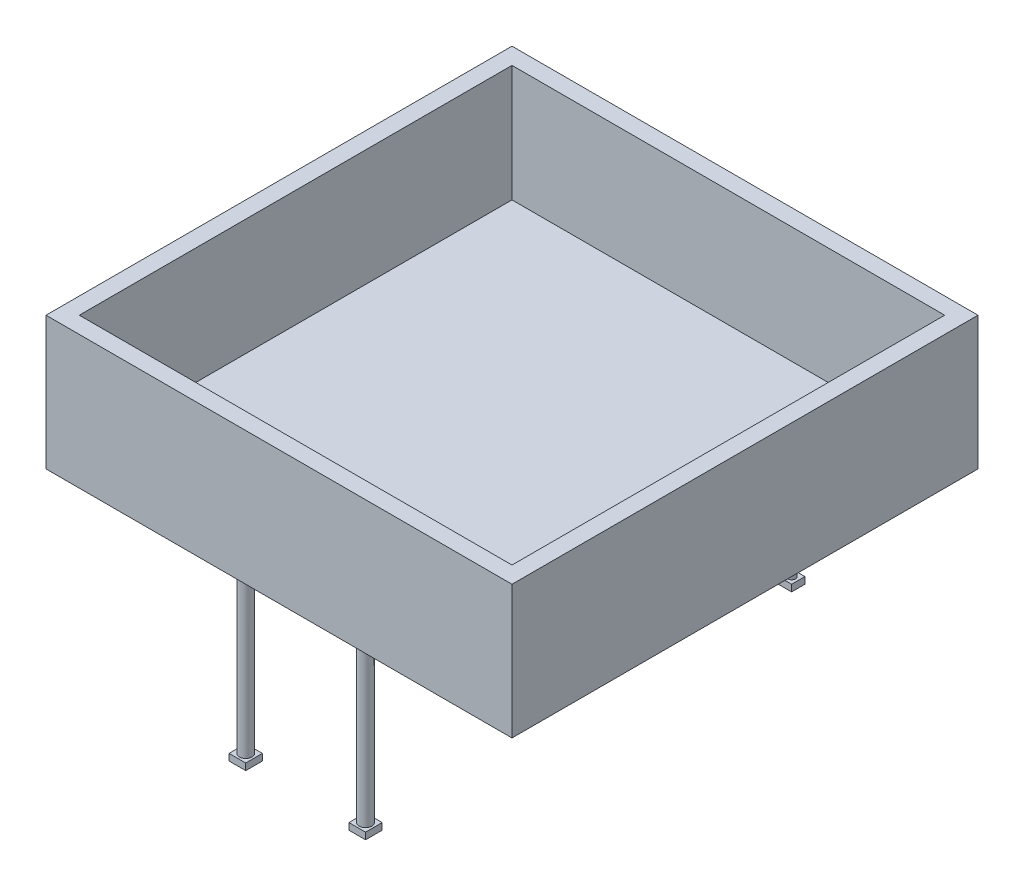
from build123d import *

# Parameters (mm, degrees)
CROQUIS1_W              = 140
CROQUIS1_H              = 140
SALIENTE_EXTRUIR1_DEPTH = 40
CROQUIS3_W              = 130
CROQUIS3_H              = 130
CORTAR_EXTRUIR1_DEPTH   = 35
CROQUIS5_R              = 1.2
CROQUIS5_R_2            = 1.9
SALIENTE_EXTRUIR4_DEPTH = 50
CROQUIS6_W              = 5
CROQUIS6_H              = 5
CROQUIS6_W_2            = 4
CROQUIS6_H_2            = 4
SALIENTE_EXTRUIR5_DEPTH = 2


with BuildPart() as part:
    # Croquis1 → Saliente-Extruir1 (new body)
    with BuildSketch(Plane(origin=(0, 0, 0), x_dir=(1, 0, 0), z_dir=(0, 1, 0))):
        Rectangle(CROQUIS1_W, CROQUIS1_H)
    extrude(amount=SALIENTE_EXTRUIR1_DEPTH)

    # Croquis3 → Cortar-Extruir1 (cut)
    with BuildSketch(Plane(origin=(0, 40, 0), x_dir=(1, 0, 0), z_dir=(0, 1, 0))):
        Rectangle(CROQUIS3_W, CROQUIS3_H)
    extrude(amount=-CORTAR_EXTRUIR1_DEPTH, mode=Mode.SUBTRACT)

    # Croquis5 → Saliente-Extruir4 (add)
    with BuildSketch(Plane.XZ):
        with Locations(Location((-16, -64, 0), (0, 0, 90))):
            Circle(CROQUIS5_R)
        with Locations(Location((-16, 64, 0), (0, 0, 90))):
            Circle(CROQUIS5_R_2)
        with Locations(Location((20, 64, 0), (0, 0, 90))):
            Circle(CROQUIS5_R_2)
        with Locations(Location((20, -64, 0), (0, 0, 90))):
            Circle(CROQUIS5_R)
    extrude(amount=SALIENTE_EXTRUIR4_DEPTH)

    # Croquis6 → Saliente-Extruir5 (add)
    with BuildSketch(Plane.XZ.offset(50)):
        with Locations((-16, 64)):
            Rectangle(CROQUIS6_W, CROQUIS6_H)
        with Locations((20, 64)):
            Rectangle(CROQUIS6_W, CROQUIS6_H)
        with Locations((-16, -64)):
            Rectangle(CROQUIS6_W_2, CROQUIS6_H_2)
        with Locations((20, -64)):
            Rectangle(CROQUIS6_W_2, CROQUIS6_H_2)
    extrude(amount=SALIENTE_EXTRUIR5_DEPTH)


solid = part.part
